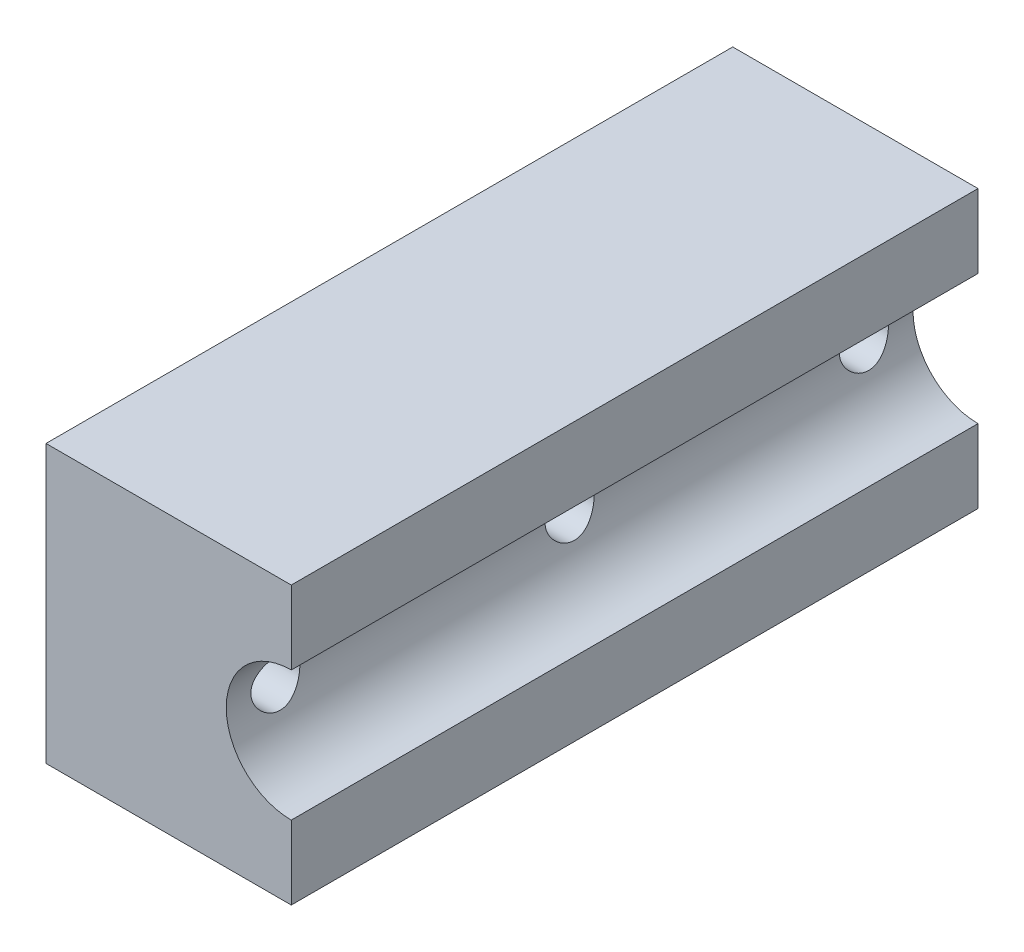
from build123d import *

# Parameters (mm, degrees)
BOSS_EXTRUDE1_DEPTH = 70
SKETCH2_R           = 2.5
CUT_EXTRUDE1_DEPTH  = 76.660528844


with BuildPart() as part:
    # Sketch1 → Boss-Extrude1 (new body)
    with BuildSketch(Plane.XY):
        with BuildLine():
            Line((0, 6.625), (0, 14.125))
            Line((0, 14.125), (-25, 14.125))
            Line((-25, 14.125), (-25, -14.125))
            Line((-25, -14.125), (0, -14.125))
            Line((0, -14.125), (0, -6.625))
            ThreePointArc((0, -6.625), (-6.625, 0), (0, 6.625))
        make_face()
    extrude(amount=BOSS_EXTRUDE1_DEPTH)

    # Sketch2 → Cut-Extrude1 (cut, through all)
    with BuildSketch(Plane.ZY.offset(25)):
        with Locations((5, 0)):
            Circle(SKETCH2_R)
        with Locations((35, 0)):
            Circle(SKETCH2_R)
        with Locations((65, 0)):
            Circle(SKETCH2_R)
    extrude(amount=-CUT_EXTRUDE1_DEPTH, mode=Mode.SUBTRACT)


solid = part.part
